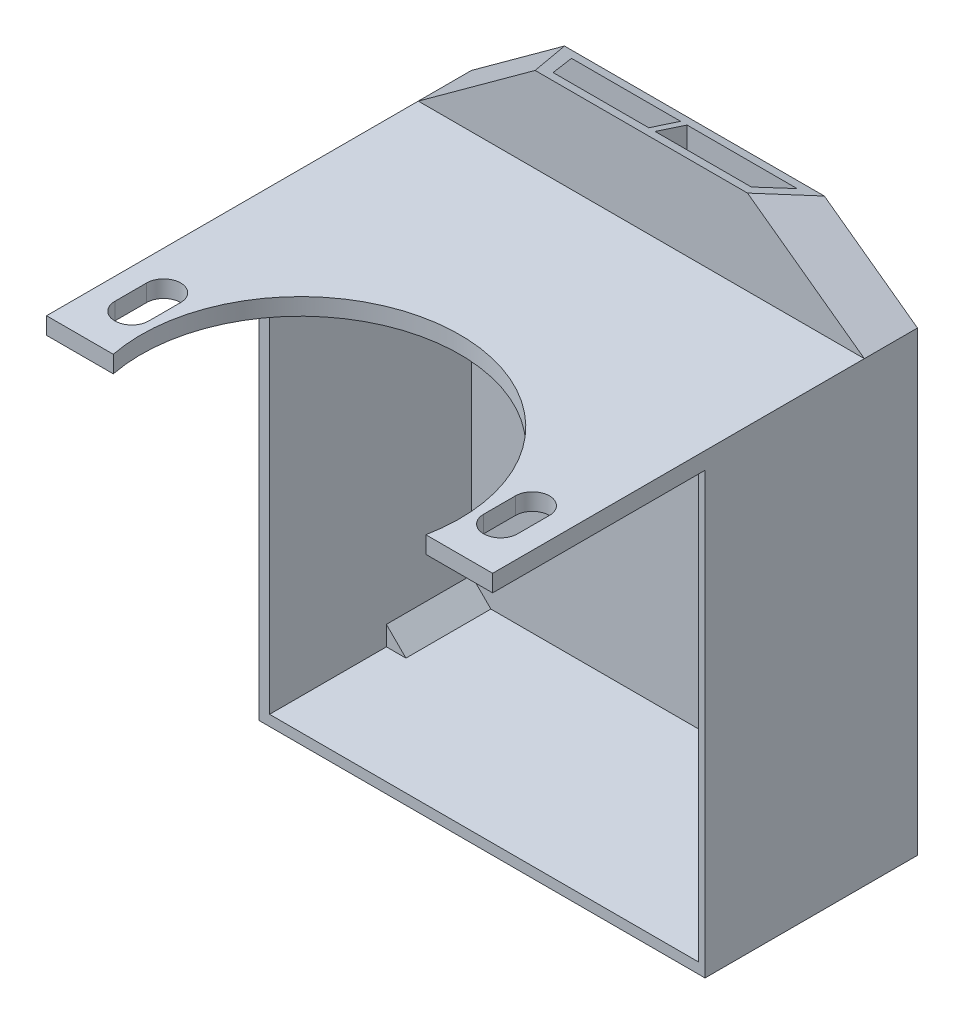
from build123d import *

# Parameters (mm, degrees)
SKETCH_1_W               = 42
SKETCH_1_H               = 43
EXTRUDE_1_DEPTH          = 20
SKETCH_2_W               = 40.4
SKETCH_2_H               = 40.4
CUT_EXTRUDE_1_DEPTH      = 19
EXTRUDE_2_DEPTH          = 5
CUT_EXTRUDE_2_DEPTH      = 3
EXTRUDE_3_DEPTH          = 8
SKETCH_7_W               = 42
SKETCH_7_H               = 1.6
EXTRUDE_4_DEPTH          = 20
SKETCH_8_R               = 15
CUT_EXTRUDE_3_DEPTH      = 20
SKETCH_9_W               = 0.6
SKETCH_9_H               = 9.6
EXTRUDE_5_DEPTH          = 3
CUT_EXTRUDE_4_DEPTH      = 20
CUT_EXTRUDE_4_DEPTH_BACK = 20


with BuildPart() as part:
    # 草图1 → 凸台-拉伸1 (new body)
    with BuildSketch(Plane.XY):
        with Locations((21, 21.5)):
            Rectangle(SKETCH_1_W, SKETCH_1_H)
    extrude(amount=EXTRUDE_1_DEPTH)

    # 草图2 → 切除-拉伸1 (cut)
    with BuildSketch(Plane.XY.offset(20)):
        with Locations((21.2, 21.2)):
            Rectangle(SKETCH_2_W, SKETCH_2_H)
    extrude(amount=-CUT_EXTRUDE_1_DEPTH, mode=Mode.SUBTRACT)

    # 草图3 → 凸台-拉伸2 (add)
    with BuildSketch(Plane(origin=(0, 0, 0), x_dir=(-1, 0, 0), z_dir=(0, 0, -1))):
        Polygon((-42, 43), (0, 43), (-11, 51), (-31, 51), align=None)
    extrude(amount=-EXTRUDE_2_DEPTH)

    # 草图5 → 切除-拉伸2 (cut)
    with BuildSketch(Plane.XY.offset(1)):
        Polygon((1, 41.4), (1, 42.434468933), (13.156473194, 51.802822617), (28.849580276, 51.802822617), (41.4, 42.434468933), (41.4, 41.4), align=None)
    extrude(amount=CUT_EXTRUDE_2_DEPTH, mode=Mode.SUBTRACT)

    # 草图6 → 凸台-拉伸3 (add)
    with BuildSketch(Plane.XY.offset(1)):
        Polygon((1, 41.4), (1, 39.954103811), (2.344864369, 41.4), align=None)
        Polygon((41.4, 41.4), (41.4, 39.954103811), (39.954103811, 41.4), align=None)
        Polygon((41.4, 1), (41.4, 2.836916903), (39.563083097, 1), align=None)
        Polygon((1, 1), (1, 2.836916903), (2.836916903, 1), align=None)
    extrude(amount=EXTRUDE_3_DEPTH)

    # 草图7 → 凸台-拉伸4 (add)
    with BuildSketch(Plane.XY.offset(20)):
        with Locations((21, 42.2)):
            Rectangle(SKETCH_7_W, SKETCH_7_H)
    extrude(amount=EXTRUDE_4_DEPTH)

    # 草图8 → 切除-拉伸3 (cut)
    with BuildSketch(Plane.XZ.offset(-41.4)):
        with Locations((21, 37.088393363)):
            Circle(SKETCH_8_R)
        with BuildLine():
            Line((2.04, 32.61), (2.04, 35.61))
            ThreePointArc((2.04, 35.61), (3.64, 37.21), (5.24, 35.61))
            Line((5.24, 35.61), (5.24, 32.61))
            ThreePointArc((5.24, 32.61), (3.64, 31.01), (2.04, 32.61))
        make_face()
        with BuildLine():
            Line((39.96, 32.61), (39.96, 35.61))
            ThreePointArc((39.96, 35.61), (38.36, 37.21), (36.76, 35.61))
            Line((36.76, 35.61), (36.76, 32.61))
            ThreePointArc((36.76, 32.61), (38.36, 31.01), (39.96, 32.61))
        make_face()
    extrude(amount=-CUT_EXTRUDE_3_DEPTH, mode=Mode.SUBTRACT)

    # 草图9 → 凸台-拉伸5 (add)
    with BuildSketch(Plane.XY.offset(1)):
        with Locations((21, 46.2)):
            Rectangle(SKETCH_9_W, SKETCH_9_H)
    extrude(amount=EXTRUDE_5_DEPTH)

    # 草图10 → 切除-拉伸4 (cut, two sides: drawn at the far end of the back side and taken through both)
    with BuildSketch(Plane.ZY.offset(-20.7).offset(-CUT_EXTRUDE_4_DEPTH_BACK)):
        Polygon((5, 51), (-3.034223026, 48.389522695), (-3.034223026, 51), align=None)
    extrude(amount=CUT_EXTRUDE_4_DEPTH + CUT_EXTRUDE_4_DEPTH_BACK, mode=Mode.SUBTRACT)


solid = part.part
